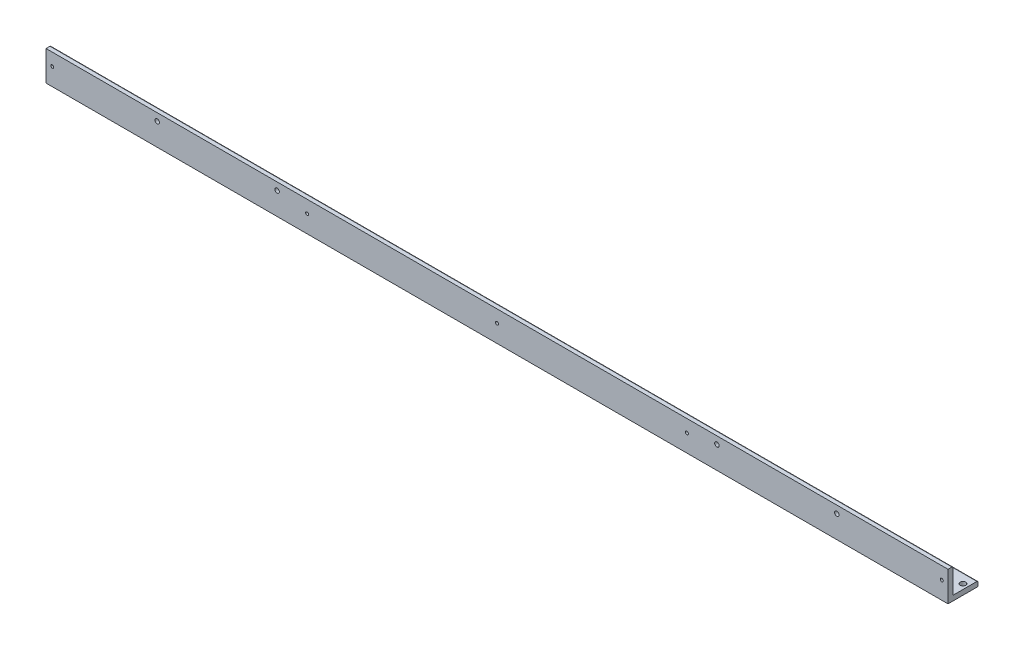
from build123d import *

# Parameters (mm, degrees)
EXTRUDE1_DEPTH          = 573.0875
F_1_4_CLEARANCE_HOLE1_D = 7.14248
F_10_24_TAPPED_HOLE1_D  = 3.7973
F_10_CLEARANCE_HOLE1_D  = 5.6134


with BuildPart() as part:
    # Sketch1 → Extrude1 (new, symmetric)
    with BuildSketch(Plane(origin=(0, 0, 0), x_dir=(0, 0, -1), z_dir=(1, 0, 0))):
        with BuildLine():
            Line((0, 38.1), (0, 0))
            Line((0, 0), (38.1, 0))
            Line((38.1, 0), (38.1, 4.826))
            ThreePointArc((38.1, 4.826), (37.653630735, 5.903630735), (36.576, 6.35))
            Line((36.576, 6.35), (6.35, 6.35))
            Line((6.35, 6.35), (6.35, 36.576))
            ThreePointArc((6.35, 36.576), (5.903630735, 37.653630735), (4.826, 38.1))
            Line((4.826, 38.1), (0, 38.1))
        make_face()
    extrude(amount=EXTRUDE1_DEPTH, both=True)

    # 1/4 Clearance Hole1 (through all)
    with Locations(Plane(origin=(0, 6.35, 0), x_dir=(-1, 0, 0), z_dir=(0, 1, 0))):
        with Locations((-566.7375, -25.4), (566.7375, -25.4)):
            Hole(F_1_4_CLEARANCE_HOLE1_D / 2)

    # #10-24 Tapped Hole1 (through all)
    with Locations(Plane.XY):
        with Locations((-565.15, 22.225), (565.15, 22.225), (-241.3, 22.225), (241.3, 22.225), (0, 22.225)):
            Hole(F_10_24_TAPPED_HOLE1_D / 2)

    # #10 Clearance Hole1 (through all)
    with Locations(Plane.XY):
        with Locations((-431.8, 28.575), (-279.4, 28.575), (279.4, 28.575), (431.8, 28.575)):
            Hole(F_10_CLEARANCE_HOLE1_D / 2)


solid = part.part
